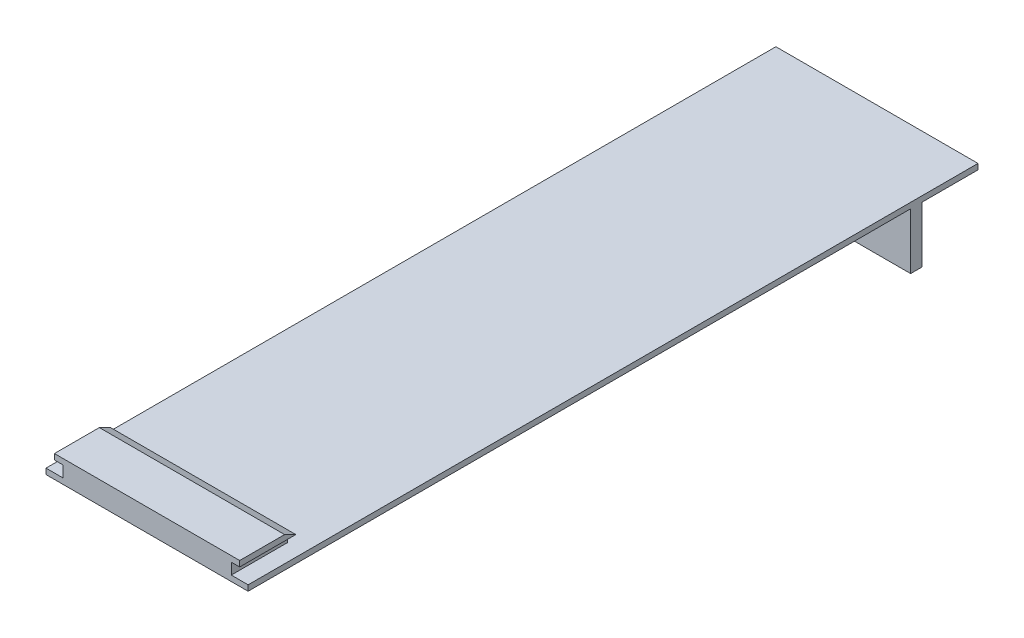
from build123d import *

# Parameters (mm, degrees)
SKETCH1_W           = 36
SKETCH1_H           = 1
BOSS_EXTRUDE1_DEPTH = 65
BOSS_EXTRUDE2_DEPTH = 5
SKETCH3_W           = 36
SKETCH3_H           = 2
BOSS_EXTRUDE3_DEPTH = 10
CUT_EXTRUDE1_REACH  = 76.334


with BuildPart() as part:
    # Sketch1 → Boss-Extrude1 (new, symmetric)
    with BuildSketch(Plane.XY):
        Rectangle(SKETCH1_W, SKETCH1_H)
    extrude(amount=BOSS_EXTRUDE1_DEPTH, both=True)

    # Sketch2 → Boss-Extrude2 (add, symmetric)
    with BuildSketch(Plane.XY.offset(60)):
        Polygon((-15, 0.5), (-15, 2.5), (-16.5, 2.5), (-16.5, 3.5), (16.5, 3.5), (16.5, 2.5), (15, 2.5), (15, 0.5), align=None)
    extrude(amount=BOSS_EXTRUDE2_DEPTH, both=True)

    # Sketch3 → Boss-Extrude3 (add)
    with BuildSketch(Plane.XZ.offset(0.5)):
        with Locations((0, -54)):
            Rectangle(SKETCH3_W, SKETCH3_H)
    extrude(amount=BOSS_EXTRUDE3_DEPTH)

    # Sketch4 → Cut-Extrude1 (cut, up to next)
    with BuildSketch(Plane(origin=(16.5, 0, 0), x_dir=(0, 0, -1), z_dir=(1, 0, 0)), mode=Mode.PRIVATE) as cut_extrude1_sk1:
        Polygon((-57, 3.5), (-55, 2.5), (-55, 3.5), align=None)
    cut_extrude1_tool1 = extrude(cut_extrude1_sk1.sketch, amount=-CUT_EXTRUDE1_REACH, mode=Mode.PRIVATE) & part.part
    add(cut_extrude1_tool1.solids().sort_by_distance((16.5, 3.166667, 55.666667))[0], mode=Mode.SUBTRACT)


solid = part.part
